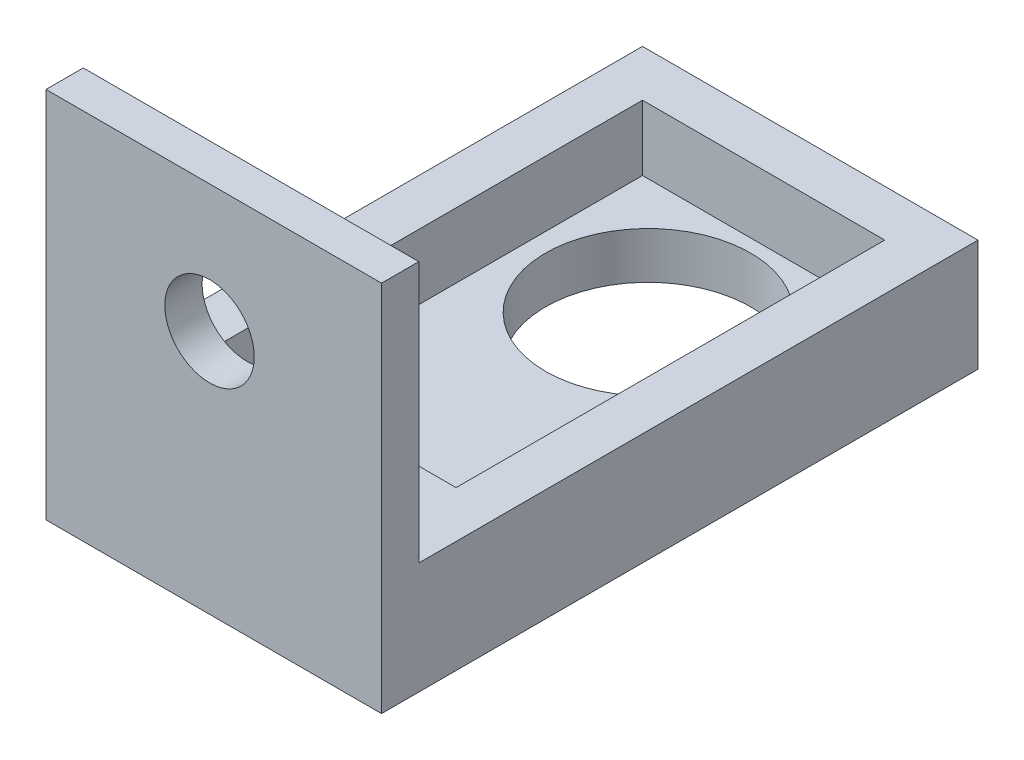
from build123d import *

# Parameters (mm, degrees)
SKETCH1_W           = 18
SKETCH1_H           = 32
BOSS_EXTRUDE1_DEPTH = 6
SKETCH2_W           = 13
SKETCH2_H           = 23
CUT_EXTRUDE1_DEPTH  = 3.5
SKETCH3_R           = 5.5
CUT_EXTRUDE2_DEPTH  = 37.881567212
SKETCH4_W           = 18
SKETCH4_H           = 2
BOSS_EXTRUDE2_DEPTH = 14
SKETCH5_R           = 2.4
CUT_EXTRUDE3_DEPTH  = 41.298883359


with BuildPart() as part:
    # Sketch1 → Boss-Extrude1 (new body)
    with BuildSketch(Plane(origin=(0, 0, 0), x_dir=(1, 0, 0), z_dir=(0, 1, 0))):
        with Locations((9, 16)):
            Rectangle(SKETCH1_W, SKETCH1_H)
    extrude(amount=BOSS_EXTRUDE1_DEPTH)

    # Sketch2 → Cut-Extrude1 (cut)
    with BuildSketch(Plane(origin=(0, 6, 0), x_dir=(1, 0, 0), z_dir=(0, 1, 0))):
        with Locations((9, 18)):
            Rectangle(SKETCH2_W, SKETCH2_H)
    extrude(amount=-CUT_EXTRUDE1_DEPTH, mode=Mode.SUBTRACT)

    # Sketch3 → Cut-Extrude2 (cut, through all)
    with BuildSketch(Plane(origin=(0, 2.5, 0), x_dir=(1, 0, 0), z_dir=(0, 1, 0))):
        with Locations(Location((9.000820155, 23.3, 0), (0, 0, 270))):
            Circle(SKETCH3_R)
    extrude(amount=-CUT_EXTRUDE2_DEPTH, mode=Mode.SUBTRACT)

    # Sketch4 → Boss-Extrude2 (add)
    with BuildSketch(Plane(origin=(0, 6, 0), x_dir=(1, 0, 0), z_dir=(0, 1, 0))):
        with Locations((9, 1)):
            Rectangle(SKETCH4_W, SKETCH4_H)
    extrude(amount=BOSS_EXTRUDE2_DEPTH)

    # Sketch5 → Cut-Extrude3 (cut, through all)
    with BuildSketch(Plane(origin=(0, 0, -2), x_dir=(-1, 0, 0), z_dir=(0, 0, -1))):
        with Locations((-8.774181154, 13.15523395)):
            Circle(SKETCH5_R)
    extrude(amount=-CUT_EXTRUDE3_DEPTH, mode=Mode.SUBTRACT)


solid = part.part
